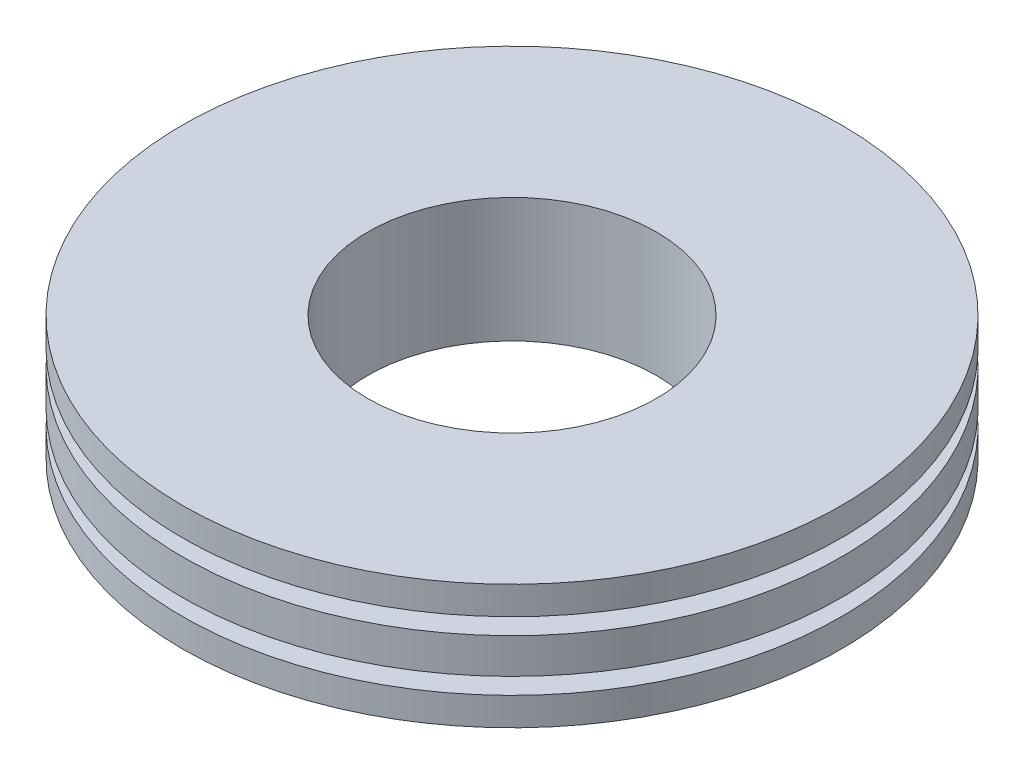
from build123d import *

# Parameters (mm, degrees)
SKETCH1_R           = 9.385
SKETCH1_R_2         = 4.11
BOSS_EXTRUDE1_DEPTH = 3.54
SKETCH2_W           = 1.774911553
SKETCH2_H           = 0.467659067


with BuildPart() as part:
    # Sketch1 → Boss-Extrude1 (new body)
    with BuildSketch(Plane(origin=(0, 0, 0), x_dir=(1, 0, 0), z_dir=(0, 1, 0))):
        Circle(SKETCH1_R)
        Circle(SKETCH1_R_2, mode=Mode.SUBTRACT)
    extrude(amount=BOSS_EXTRUDE1_DEPTH)

    # Sketch2 → Cut-Revolve1 (revolve, cut)
    with BuildSketch(Plane.XY):
        with Locations((8.497544224, 1.033829534)):
            Rectangle(SKETCH2_W, SKETCH2_H)
        with Locations((8.497544224, 2.506170467)):
            Rectangle(SKETCH2_W, SKETCH2_H)
    revolve(axis=Axis((0, 0, 0), (0, 1, 0)), mode=Mode.SUBTRACT)


solid = part.part
